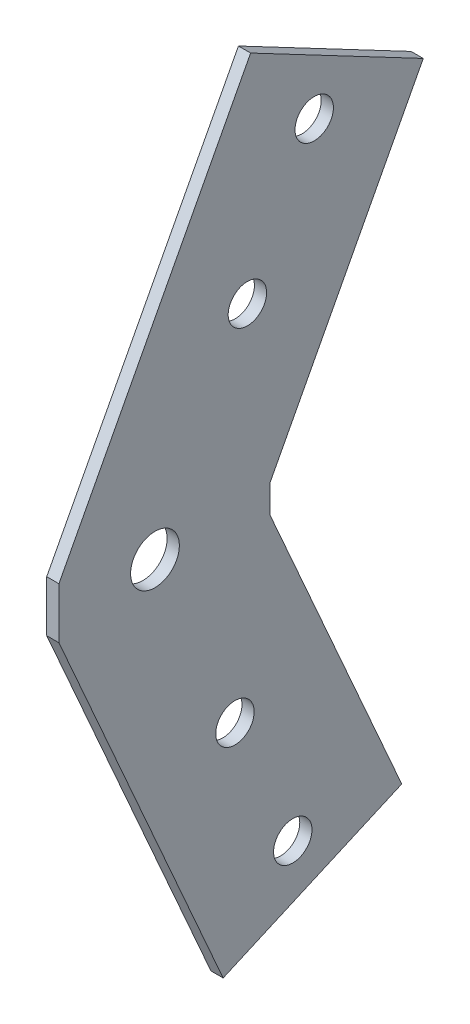
from build123d import *

# Parameters (mm, degrees)
SKETCH1_R           = 6.35
SKETCH1_R_2         = 5
BOSS_EXTRUDE1_DEPTH = 3.175


with BuildPart() as part:
    # Sketch1 → Boss-Extrude1 (new body)
    with BuildSketch(Plane.YZ):
        Polygon((-92.963597619, -40.991822572), (-82.715641976, -64.232721977), (-5.080718921, -30), (2.443726878, -30), (78.037119616, -69.842164643), (89.880151319, -47.372126813), (101.723183023, -24.902088983), (7.042880264, 25), (-6.258566793, 25), (-103.211553262, -17.750923167), align=None)
        with Locations(Location((0, 0, 0), (0, 0, 270))):
            Circle(SKETCH1_R, mode=Mode.SUBTRACT)
        with Locations(Location((-81.343147916, -35.867844751, 0), (0, 0, 270))):
            Circle(SKETCH1_R_2, mode=Mode.SUBTRACT)
        with Locations(Location((-47.213795641, -20.818681542, 0), (0, 0, 270))):
            Circle(SKETCH1_R_2, mode=Mode.SUBTRACT)
        with Locations(Location((78.645132405, -41.450610961, 0), (0, 0, 270))):
            Circle(SKETCH1_R_2, mode=Mode.SUBTRACT)
        with Locations(Location((45.647793387, -24.059072279, 0), (0, 0, 270))):
            Circle(SKETCH1_R_2, mode=Mode.SUBTRACT)
    extrude(amount=-BOSS_EXTRUDE1_DEPTH)


solid = part.part
